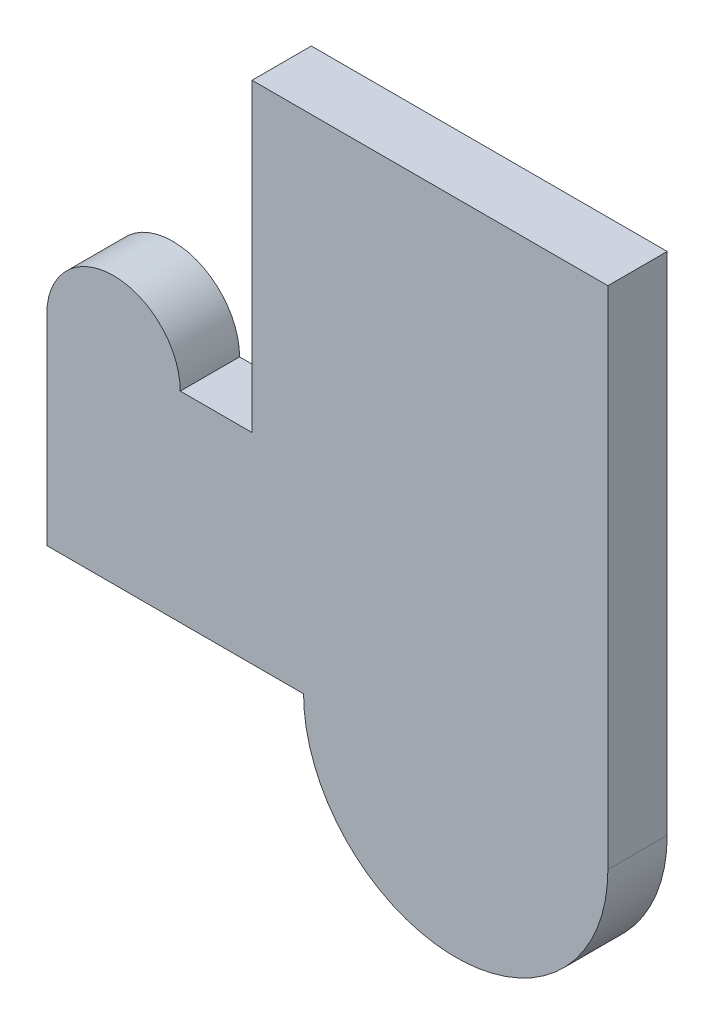
from build123d import *

# Parameters (mm, degrees)
BOSS_EXTRUDE1_DEPTH = 10


with BuildPart() as part:
    # part1 → Boss-Extrude1 (new body)
    with BuildSketch(Plane.XY):
        with BuildLine():
            Line((0, 0), (0, 51.443037975))
            Line((0, 51.443037975), (60, 51.443037975))
            Line((60, 51.443037975), (60, -33.805424955))
            ThreePointArc((60, -33.805424955), (34.345290153, -59.460134802), (8.690580306, -33.805424955))
            Line((8.690580306, -33.805424955), (-34.601742561, -33.805424955))
            Line((-34.601742561, -33.805424955), (-34.601742561, 0))
            ThreePointArc((-34.601742561, 0), (-23.351114961, 11.2506276), (-12.100487361, 0))
            Line((-12.100487361, 0), (0, 0))
        make_face()
    extrude(amount=BOSS_EXTRUDE1_DEPTH)


solid = part.part
